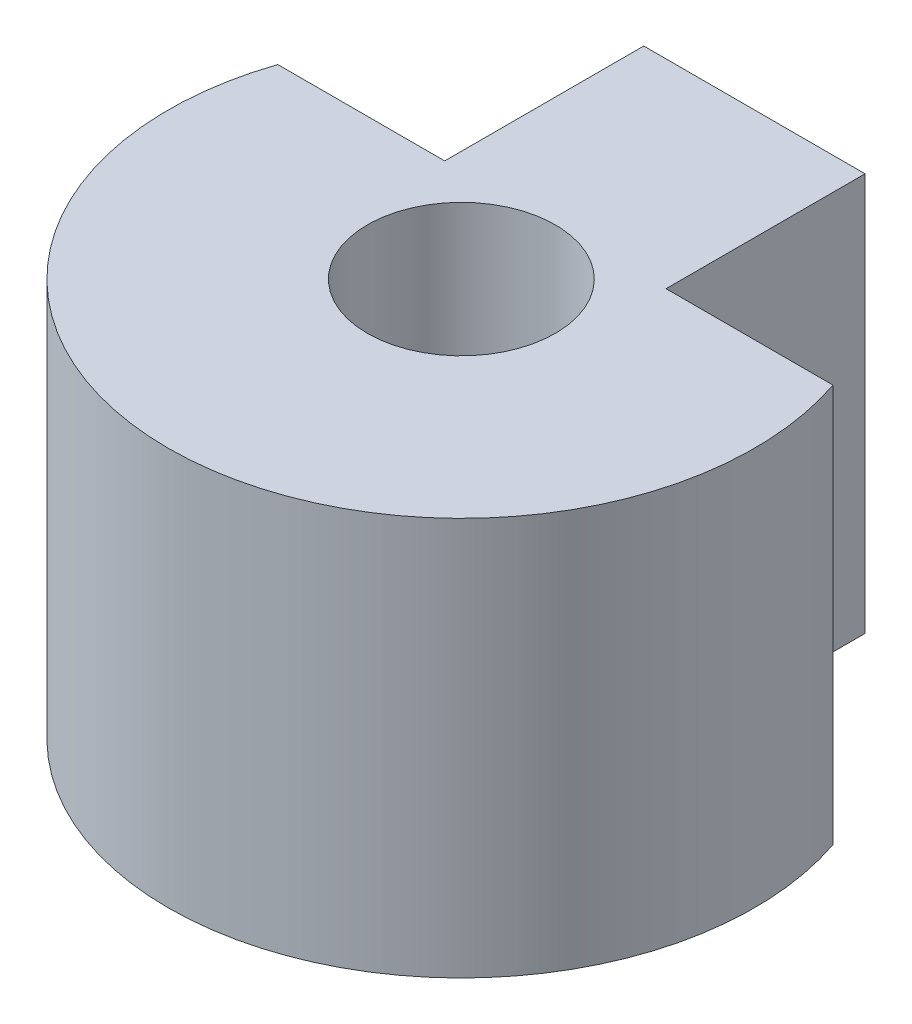
from build123d import *

# Parameters (mm, degrees)
SKETCH1_R           = 1.5
BOSS_EXTRUDE1_DEPTH = 6.35


with BuildPart() as part:
    # Sketch1 → Boss-Extrude1 (new body)
    with BuildSketch(Plane(origin=(0, 0, 0), x_dir=(1, 0, 0), z_dir=(0, 1, 0))):
        with BuildLine():
            Line((-1.7653, 1.5), (-1.7653, 4.675))
            Line((-1.7653, 4.675), (1.7653, 4.675))
            Line((1.7653, 4.675), (1.7653, 1.5))
            Line((1.7653, 1.5), (4.427823958, 1.5))
            ThreePointArc((4.427823958, 1.5), (0, -4.675), (-4.427823958, 1.5))
            Line((-4.427823958, 1.5), (-1.7653, 1.5))
        make_face()
        with Locations(Location((0, 0, 0), (0, 0, 270))):
            Circle(SKETCH1_R, mode=Mode.SUBTRACT)
    extrude(amount=BOSS_EXTRUDE1_DEPTH)


solid = part.part
